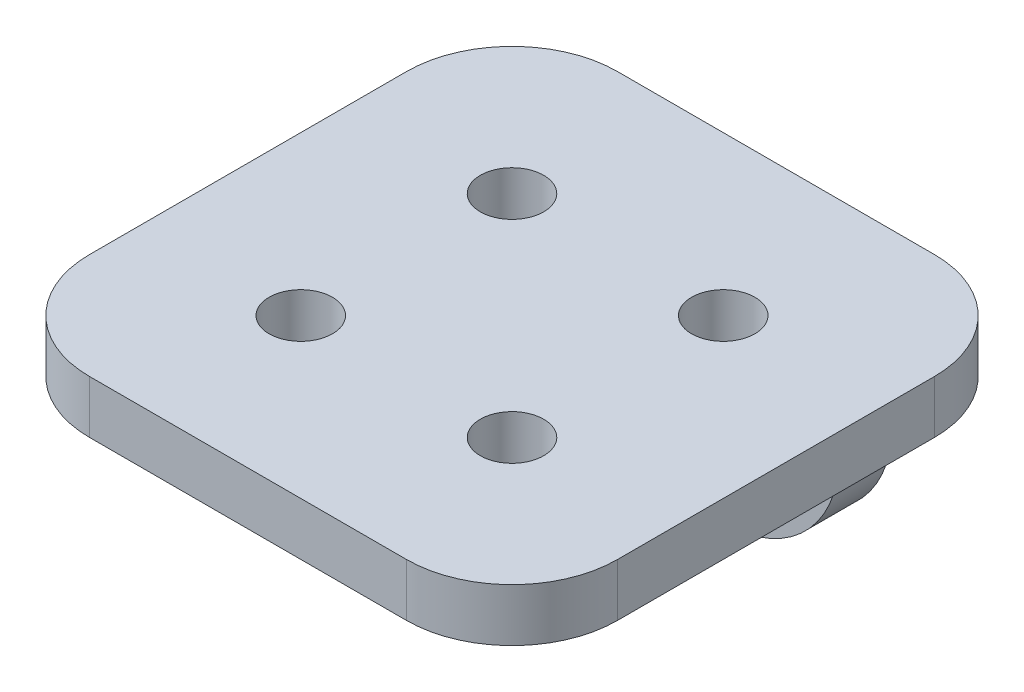
from build123d import *

# Parameters (mm, degrees)
SKETCH1_R           = 2
SKETCH1_R_2         = 5
BOSS_EXTRUDE2_DEPTH = 5
BOSS_EXTRUDE4_DEPTH = 5
SKETCH2_W           = 50
SKETCH2_H           = 5
BOSS_EXTRUDE7_DEPTH = 45
CUT_EXTRUDE1_REACH  = 64.081
SKETCH3_R           = 3
FILLET1_R           = 10


with BuildPart() as part:
    # Sketch1 → Boss-Extrude2 (new body)
    with BuildSketch(Plane.XY):
        with BuildLine():
            ThreePointArc((11, 0), (0, 11), (-11, 0))
            ThreePointArc((-11, 0), (0, -11), (11, 0))
        make_face()
        with Locations((-8, 0)):
            Circle(SKETCH1_R, mode=Mode.SUBTRACT)
        with Locations((0, -8)):
            Circle(SKETCH1_R, mode=Mode.SUBTRACT)
        Circle(SKETCH1_R_2, mode=Mode.SUBTRACT)
        with Locations((8, 0)):
            Circle(SKETCH1_R, mode=Mode.SUBTRACT)
        with Locations((0, 8)):
            Circle(SKETCH1_R, mode=Mode.SUBTRACT)
    extrude(amount=BOSS_EXTRUDE2_DEPTH)

    # Sketch1<9> → Boss-Extrude4 (add)
    with BuildSketch(Plane.XY):
        with BuildLine():
            Line((-25, 16), (-25, 11))
            Line((-25, 11), (-15, 11))
            Line((-15, 11), (-11, 0))
            ThreePointArc((-11, 0), (0, 11), (11, 0))
            Line((11, 0), (15, 11))
            Line((15, 11), (25, 11))
            Line((25, 11), (25, 16))
            Line((25, 16), (-25, 16))
        make_face()
    extrude(amount=BOSS_EXTRUDE4_DEPTH)

    # Sketch2 → Boss-Extrude7 (add)
    with BuildSketch(Plane.XY.offset(5)):
        with Locations((0, 13.5)):
            Rectangle(SKETCH2_W, SKETCH2_H)
    extrude(amount=BOSS_EXTRUDE7_DEPTH)

    # Sketch3 → Cut-Extrude1 (cut, up to next)
    with BuildSketch(Plane(origin=(0, 16, 0), x_dir=(1, 0, 0), z_dir=(0, 1, 0)), mode=Mode.PRIVATE) as cut_extrude1_sk1:
        with Locations((10, -35)):
            Circle(SKETCH3_R)
    cut_extrude1_tool1 = extrude(cut_extrude1_sk1.sketch, amount=-CUT_EXTRUDE1_REACH, mode=Mode.PRIVATE) & part.part
    # Sketch3 → Cut-Extrude1 (cut, up to next)
    with BuildSketch(Plane(origin=(0, 16, 0), x_dir=(1, 0, 0), z_dir=(0, 1, 0)), mode=Mode.PRIVATE) as cut_extrude1_sk2:
        with Locations((-10, -35)):
            Circle(SKETCH3_R)
    cut_extrude1_tool2 = extrude(cut_extrude1_sk2.sketch, amount=-CUT_EXTRUDE1_REACH, mode=Mode.PRIVATE) & part.part
    # Sketch3 → Cut-Extrude1 (cut, up to next)
    with BuildSketch(Plane(origin=(0, 16, 0), x_dir=(1, 0, 0), z_dir=(0, 1, 0)), mode=Mode.PRIVATE) as cut_extrude1_sk3:
        with Locations((-10, -15)):
            Circle(SKETCH3_R)
    cut_extrude1_tool3 = extrude(cut_extrude1_sk3.sketch, amount=-CUT_EXTRUDE1_REACH, mode=Mode.PRIVATE) & part.part
    # Sketch3 → Cut-Extrude1 (cut, up to next)
    with BuildSketch(Plane(origin=(0, 16, 0), x_dir=(1, 0, 0), z_dir=(0, 1, 0)), mode=Mode.PRIVATE) as cut_extrude1_sk4:
        with Locations((10, -15)):
            Circle(SKETCH3_R)
    cut_extrude1_tool4 = extrude(cut_extrude1_sk4.sketch, amount=-CUT_EXTRUDE1_REACH, mode=Mode.PRIVATE) & part.part
    add(cut_extrude1_tool1.solids().sort_by_distance((10, 16, 35))[0], mode=Mode.SUBTRACT)
    add(cut_extrude1_tool2.solids().sort_by_distance((-10, 16, 35))[0], mode=Mode.SUBTRACT)
    add(cut_extrude1_tool3.solids().sort_by_distance((-10, 16, 15))[0], mode=Mode.SUBTRACT)
    add(cut_extrude1_tool4.solids().sort_by_distance((10, 16, 15))[0], mode=Mode.SUBTRACT)

    # Fillet1
    fillet1_edges = [part.edges().sort_by_distance(p)[0] for p in [
        (25, 13.5, 0),
        (-25, 13.5, 0),
        (-25, 13.5, 50),
        (25, 13.5, 50),
    ]]
    fillet(fillet1_edges, radius=FILLET1_R)


solid = part.part
